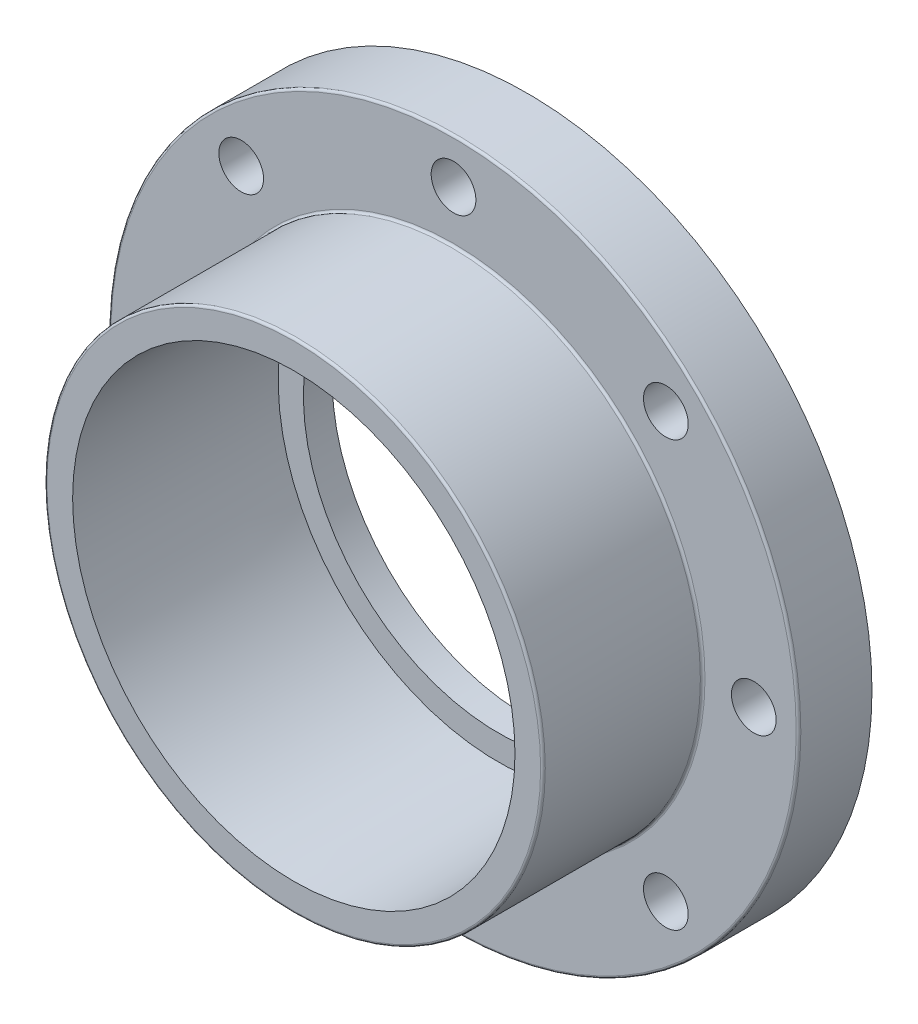
from build123d import *

# Parameters (mm, degrees)
SKETCH1_R         = 171.45
EXTRUDE1_DEPTH    = 36.5125
SKETCH2_R         = 123.825
EXTRUDE2_DEPTH    = 79.375
SKETCH3_R         = 11.1125
EXTRUDE3_DEPTH    = 256.128586452
CIRPATTERN1_COUNT = 8
FILLET1_R         = 1.154545455


with BuildPart() as part:
    # Sketch1 → Extrude1 (new body)
    with BuildSketch(Plane.XY):
        Circle(SKETCH1_R)
    extrude(amount=EXTRUDE1_DEPTH)

    # Sketch2 → Extrude2 (add)
    with BuildSketch(Plane.XY.offset(36.5125)):
        with Locations(Location((0, 0, 0), (0, 0, 180))):
            Circle(SKETCH2_R)
    extrude(amount=EXTRUDE2_DEPTH)

    # Sketch3 → Extrude3 (cut, through all)
    with BuildSketch(Plane.XY.offset(36.5125)):
        with Locations((0, 149.225)):
            Circle(SKETCH3_R)
    extrude3 = extrude(amount=-EXTRUDE3_DEPTH, mode=Mode.SUBTRACT)

    # CirPattern1: Extrude3 ×8 about axis
    cirpattern1_axis = Axis((0, 0, 0), (0, 0, 1))
    for i in range(1, CIRPATTERN1_COUNT):
        add(extrude3.rotate(cirpattern1_axis, i * 360 / CIRPATTERN1_COUNT), mode=Mode.SUBTRACT)

    # Fillet1
    fillet1_edges = [part.edges().sort_by_distance(p)[0] for p in [
        (-171.45, 0, 36.5125),
        (123.825, 0, 36.5125),
        (123.825, 0, 115.8875),
    ]]
    fillet(fillet1_edges, radius=FILLET1_R)

    # Sketch4 → Cut-Revolve1 (revolve, cut)
    with BuildSketch(Plane(origin=(0, 0, 63.5), x_dir=(0, 0, -1), z_dir=(1, 0, 0)), mode=Mode.PRIVATE) as cut_revolve1_sk:
        Polygon((-52.3875, 109.9185), (49.2125, 109.347), (49.2125, 96.8375), (63.5, 96.8375), (63.5, 0), (-52.3875, 0), align=None)
    revolve(cut_revolve1_sk.sketch.rotate(Axis((0, 0, 0), (0, 0, 1)), 270), axis=Axis((0, 0, 0), (0, 0, 1)), mode=Mode.SUBTRACT)


solid = part.part
